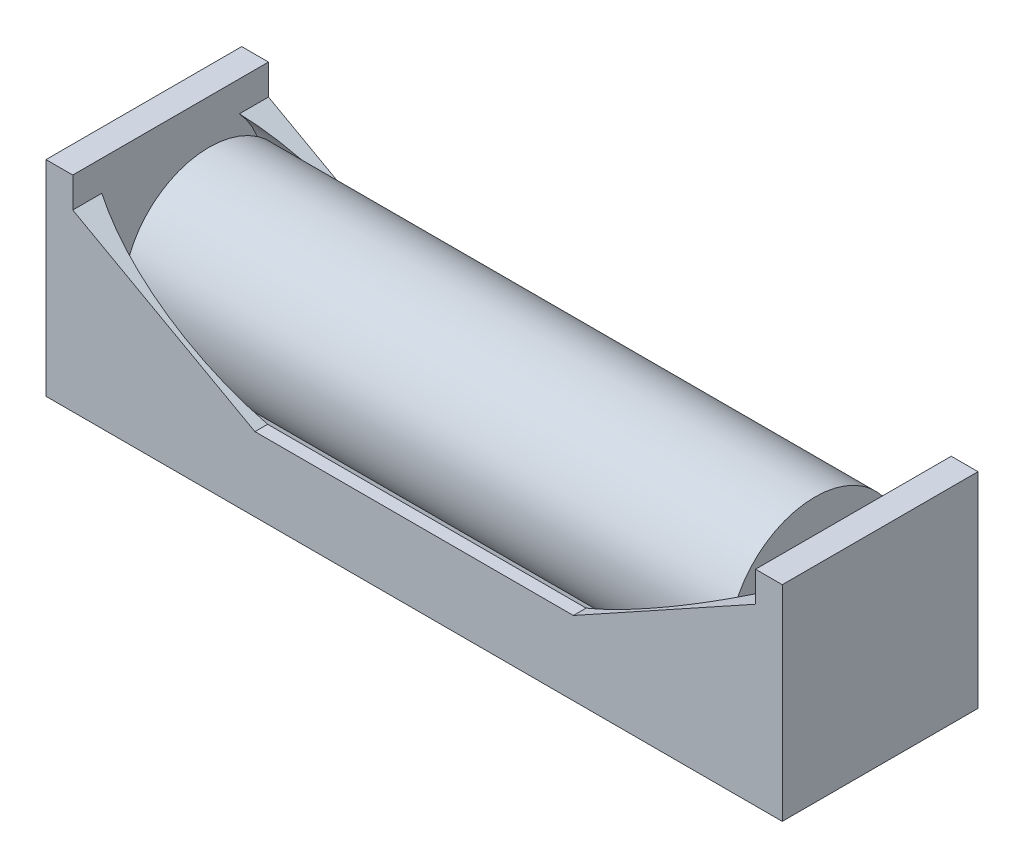
from build123d import *

# Parameters (mm, degrees)
BOSS_EXTRUDE3_DEPTH      = 32.5
BOSS_EXTRUDE3_DEPTH_BACK = 32.5
SKETCH8_R                = 9.2
SKETCH9_W                = 79
SKETCH9_H                = 21
BOSS_EXTRUDE4_DEPTH      = 22
CUT_EXTRUDE1_DEPTH       = 49.602983448
CUT_EXTRUDE2_REACH       = 81.164
SKETCH12_R               = 10


with BuildPart() as part:
    # Sketch8 → Boss-Extrude3 (new, two sides: drawn at the far end of the back side and taken through both)
    with BuildSketch(Plane(origin=(0, 0, 0), x_dir=(0, 0, -1), z_dir=(1, 0, 0)).offset(-BOSS_EXTRUDE3_DEPTH_BACK)):
        with Locations((0, 9.2)):
            Circle(SKETCH8_R)
    extrude(amount=BOSS_EXTRUDE3_DEPTH + BOSS_EXTRUDE3_DEPTH_BACK)


with BuildPart() as body_2:
    # Sketch9 → Boss-Extrude4 (new body)
    with BuildSketch(Plane(origin=(0, -3, 0), x_dir=(1, 0, 0), z_dir=(0, 1, 0))):
        Rectangle(SKETCH9_W, SKETCH9_H)
    extrude(amount=BOSS_EXTRUDE4_DEPTH)

    # Sketch11 → Cut-Extrude1 (cut, through all)
    with BuildSketch(Plane.XY.offset(10.5)):
        Polygon((-36.62898703, 19), (-36.62898703, 15.746848223), (-17.083580509, 4.929733927), (0, 4.929733927), (0, 19), align=None)
    cut_extrude1 = extrude(amount=-CUT_EXTRUDE1_DEPTH, mode=Mode.SUBTRACT)

    # Mirror1: Cut-Extrude1 across plane
    add(cut_extrude1.mirror(Plane(origin=(0, 0, 0), x_dir=(0, 0, 1), z_dir=(1, 0, 0))), mode=Mode.SUBTRACT)

    # Cut-Extrude2: up to this face of the body (flat: up to its plane)
    cut_extrude2_end = Plane(body_2.part.faces().sort_by_distance((36.62898703, 17.373424112, 0))[0])
    # Sketch12 → Cut-Extrude2 (cut, up to the picked face)
    with BuildSketch(Plane(origin=(-36.62898703, 0, 0), x_dir=(0, 0, -1), z_dir=(1, 0, 0)), mode=Mode.PRIVATE) as cut_extrude2_sk1:
        with Locations((0, 9)):
            Circle(SKETCH12_R)
    cut_extrude2_tool1 = split(extrude(cut_extrude2_sk1.sketch, amount=CUT_EXTRUDE2_REACH, mode=Mode.PRIVATE), bisect_by=cut_extrude2_end, keep=Keep.BOTH, mode=Mode.PRIVATE)
    add(cut_extrude2_tool1.solids().sort_by(Axis((-36.628987, 9, 0), (1, 0, 0)))[0], mode=Mode.SUBTRACT)


solid = Compound([part.part, body_2.part])
